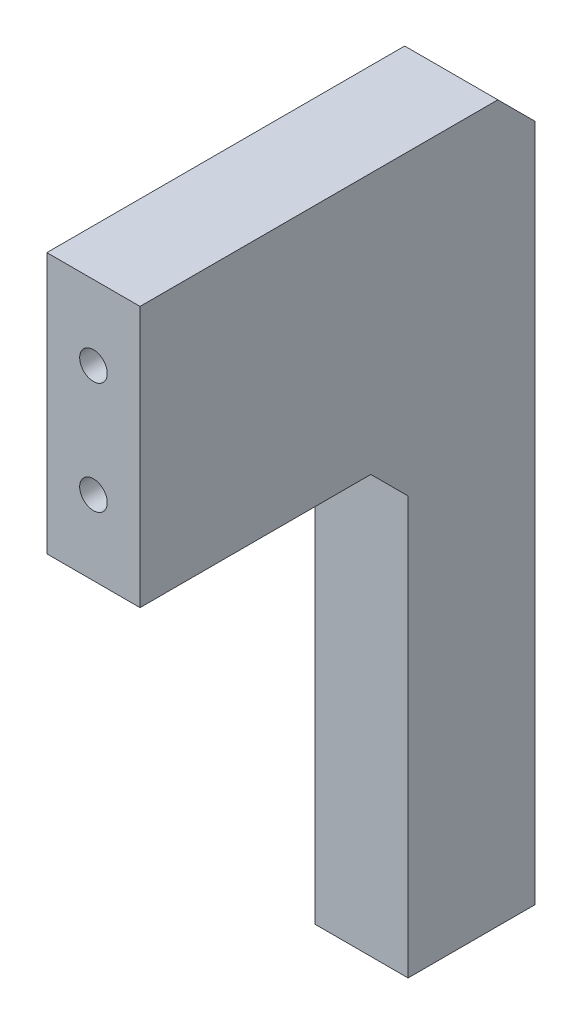
from build123d import *

# Parameters (mm, degrees)
BOSS_EXTRUDE1_DEPTH            = 6.25
CHAMFER1_SIZE                  = 5
F_3_7_3_7_DIAMETER_HOLE1_D     = 3.7
F_3_7_3_7_DIAMETER_HOLE1_DEPTH = 12
F_3_7_3_7_DIAMETER_HOLE1_TIP   = 1.111592145
F_3_7_3_7_DIAMETER_HOLE2_D     = 3.7
F_3_7_3_7_DIAMETER_HOLE2_DEPTH = 20
F_3_7_3_7_DIAMETER_HOLE2_TIP   = 1.111592145


with BuildPart() as part:
    # Sketch1 → Boss-Extrude1 (new, symmetric)
    with BuildSketch(Plane(origin=(0, 0, 0), x_dir=(0, 0, -1), z_dir=(1, 0, 0))):
        Polygon((0, 0), (-17.045, 0), (-17.045, 61), (-53, 61), (-53, 96), (0, 96), align=None)
    extrude(amount=BOSS_EXTRUDE1_DEPTH, both=True)

    # Chamfer1
    chamfer1_edges = [part.edges().sort_by_distance(p)[0] for p in [
        (0, 61, 17.045),
        (0, 96, 0),
    ]]
    chamfer(chamfer1_edges, length=CHAMFER1_SIZE)

    # Ø3.7 (3.7) Diameter Hole1
    with Locations(Plane.XY.offset(53)):
        with Locations((0, 86), (0, 71)):
            Hole(F_3_7_3_7_DIAMETER_HOLE1_D / 2, depth=F_3_7_3_7_DIAMETER_HOLE1_DEPTH)
            with Locations((0, 0, -(F_3_7_3_7_DIAMETER_HOLE1_DEPTH + F_3_7_3_7_DIAMETER_HOLE1_TIP / 2))):  # 118° drill point
                Cone(0, F_3_7_3_7_DIAMETER_HOLE1_D / 2, F_3_7_3_7_DIAMETER_HOLE1_TIP, mode=Mode.SUBTRACT)

    # Ø3.7 (3.7) Diameter Hole2
    with Locations(Plane(origin=(0, 0, 0), x_dir=(-1, 0, 0), z_dir=(0, -1, 0))):
        with Locations((0, -10.22)):
            Hole(F_3_7_3_7_DIAMETER_HOLE2_D / 2, depth=F_3_7_3_7_DIAMETER_HOLE2_DEPTH)
            with Locations((0, 0, -(F_3_7_3_7_DIAMETER_HOLE2_DEPTH + F_3_7_3_7_DIAMETER_HOLE2_TIP / 2))):  # 118° drill point
                Cone(0, F_3_7_3_7_DIAMETER_HOLE2_D / 2, F_3_7_3_7_DIAMETER_HOLE2_TIP, mode=Mode.SUBTRACT)


solid = part.part
